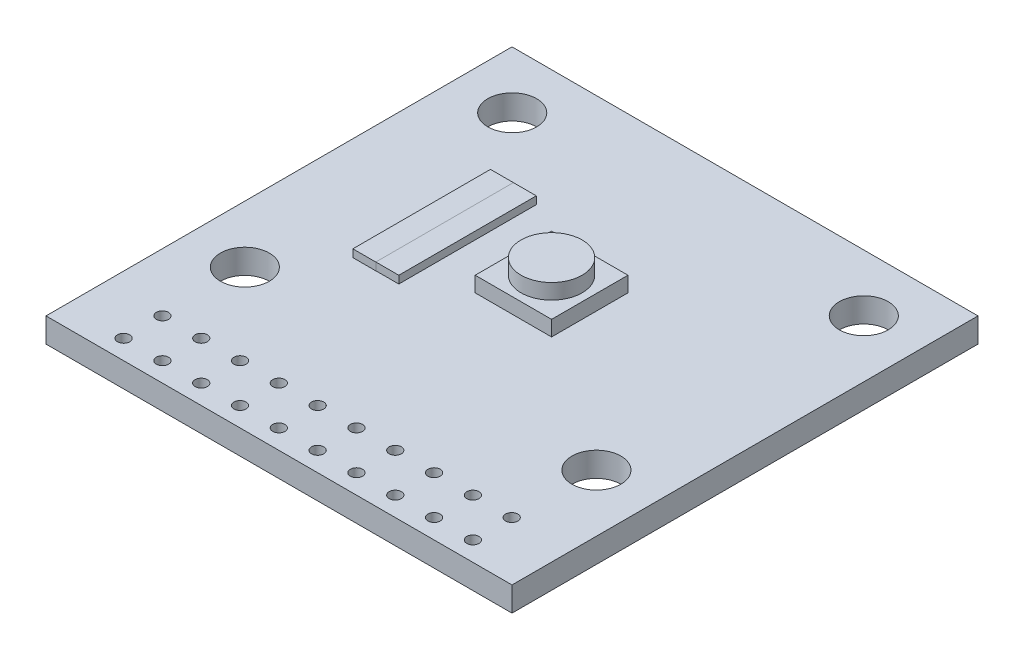
from build123d import *

# Parameters (mm, degrees)
CROQUIS1_W              = 30.5
CROQUIS1_H              = 30.5
SALIENTE_EXTRUIR1_DEPTH = 1.6
CROQUIS2_R              = 1.6
CORTAR_EXTRUIR3_DEPTH   = 22.626025987
CROQUIS3_R              = 0.4
CORTAR_EXTRUIR4_DEPTH   = 22.626025987
CROQUIS4_W              = 5
CROQUIS4_H              = 5
SALIENTE_EXTRUIR2_DEPTH = 1
CROQUIS5_R              = 2
SALIENTE_EXTRUIR3_DEPTH = 1
CROQUIS6_W              = 1.5
CROQUIS6_H              = 9
SALIENTE_EXTRUIR4_DEPTH = 0.5
CROQUIS7_W              = 1.5
CROQUIS7_H              = 9.005636498
SALIENTE_EXTRUIR6_DEPTH = 0.5


with BuildPart() as part:
    # Croquis1 → Saliente-Extruir1 (new body)
    with BuildSketch(Plane(origin=(0, 0, 0), x_dir=(1, 0, 0), z_dir=(0, 1, 0))):
        Rectangle(CROQUIS1_W, CROQUIS1_H)
    extrude(amount=SALIENTE_EXTRUIR1_DEPTH)

    # Croquis2 → Cortar-Extruir3 (cut, through all)
    with BuildSketch(Plane(origin=(0, 1.6, 0), x_dir=(1, 0, 0), z_dir=(0, 1, 0))):
        with Locations(Location((-11.505, 11.52, 0), (0, 0, 270))):
            Circle(CROQUIS2_R)
        with Locations(Location((11.505, 11.52, 0), (0, 0, 90))):
            Circle(CROQUIS2_R)
        with Locations(Location((11.505, -5.98, 0), (0, 0, 270))):
            Circle(CROQUIS2_R)
        with Locations(Location((-11.505, -5.98, 0), (0, 0, 270))):
            Circle(CROQUIS2_R)
    extrude(amount=-CORTAR_EXTRUIR3_DEPTH, mode=Mode.SUBTRACT)

    # Croquis3 → Cortar-Extruir4 (cut, through all)
    with BuildSketch(Plane(origin=(0, 1.6, 0), x_dir=(1, 0, 0), z_dir=(0, 1, 0))):
        with Locations(Location((-11.44, -13.98, 0), (0, 0, 270))):
            Circle(CROQUIS3_R)
        with Locations(Location((-8.9, -13.98, 0), (0, 0, 270))):
            Circle(CROQUIS3_R)
        with Locations(Location((-6.36, -13.98, 0), (0, 0, 270))):
            Circle(CROQUIS3_R)
        with Locations(Location((-3.82, -13.98, 0), (0, 0, 270))):
            Circle(CROQUIS3_R)
        with Locations(Location((-1.28, -13.98, 0), (0, 0, 270))):
            Circle(CROQUIS3_R)
        with Locations(Location((1.26, -13.98, 0), (0, 0, 270))):
            Circle(CROQUIS3_R)
        with Locations(Location((3.8, -13.98, 0), (0, 0, 270))):
            Circle(CROQUIS3_R)
        with Locations(Location((6.34, -13.98, 0), (0, 0, 270))):
            Circle(CROQUIS3_R)
        with Locations(Location((8.88, -13.98, 0), (0, 0, 270))):
            Circle(CROQUIS3_R)
        with Locations(Location((11.42, -13.98, 0), (0, 0, 270))):
            Circle(CROQUIS3_R)
        with Locations(Location((-11.44, -11.44, 0), (0, 0, 270))):
            Circle(CROQUIS3_R)
        with Locations(Location((-8.9, -11.44, 0), (0, 0, 270))):
            Circle(CROQUIS3_R)
        with Locations(Location((-6.36, -11.44, 0), (0, 0, 270))):
            Circle(CROQUIS3_R)
        with Locations(Location((-3.82, -11.44, 0), (0, 0, 270))):
            Circle(CROQUIS3_R)
        with Locations(Location((-1.28, -11.44, 0), (0, 0, 270))):
            Circle(CROQUIS3_R)
        with Locations(Location((1.26, -11.44, 0), (0, 0, 270))):
            Circle(CROQUIS3_R)
        with Locations(Location((3.8, -11.44, 0), (0, 0, 270))):
            Circle(CROQUIS3_R)
        with Locations(Location((6.34, -11.44, 0), (0, 0, 270))):
            Circle(CROQUIS3_R)
        with Locations(Location((8.88, -11.44, 0), (0, 0, 270))):
            Circle(CROQUIS3_R)
        with Locations(Location((11.42, -11.44, 0), (0, 0, 270))):
            Circle(CROQUIS3_R)
    extrude(amount=-CORTAR_EXTRUIR4_DEPTH, mode=Mode.SUBTRACT)

    # Croquis4 → Saliente-Extruir2 (add)
    with BuildSketch(Plane(origin=(0, 1.6, 0), x_dir=(1, 0, 0), z_dir=(0, 1, 0))):
        with Locations((-0.01, 2.6)):
            Rectangle(CROQUIS4_W, CROQUIS4_H)
    extrude(amount=SALIENTE_EXTRUIR2_DEPTH)

    # Croquis5 → Saliente-Extruir3 (add)
    with BuildSketch(Plane(origin=(0, 2.6, 0), x_dir=(1, 0, 0), z_dir=(0, 1, 0))):
        with Locations(Location((-0.01, 2.6, 0), (0, 0, 90))):
            Circle(CROQUIS5_R)
    extrude(amount=SALIENTE_EXTRUIR3_DEPTH)

    # Croquis6 → Saliente-Extruir4 (add)
    with BuildSketch(Plane(origin=(0, 1.6, 0), x_dir=(1, 0, 0), z_dir=(0, 1, 0))):
        with Locations((-6.26, 2.6)):
            Rectangle(CROQUIS6_W, CROQUIS6_H)
    extrude(amount=SALIENTE_EXTRUIR4_DEPTH)


with BuildPart() as body_2:
    # Croquis7 → Saliente-Extruir6 (new body)
    with BuildSketch(Plane(origin=(0, 1.6, 0), x_dir=(1, 0, 0), z_dir=(0, 1, 0))):
        with Locations((-7.76, 2.597181751)):
            Rectangle(CROQUIS7_W, CROQUIS7_H)
    extrude(amount=SALIENTE_EXTRUIR6_DEPTH)


solid = Compound([part.part, body_2.part])
